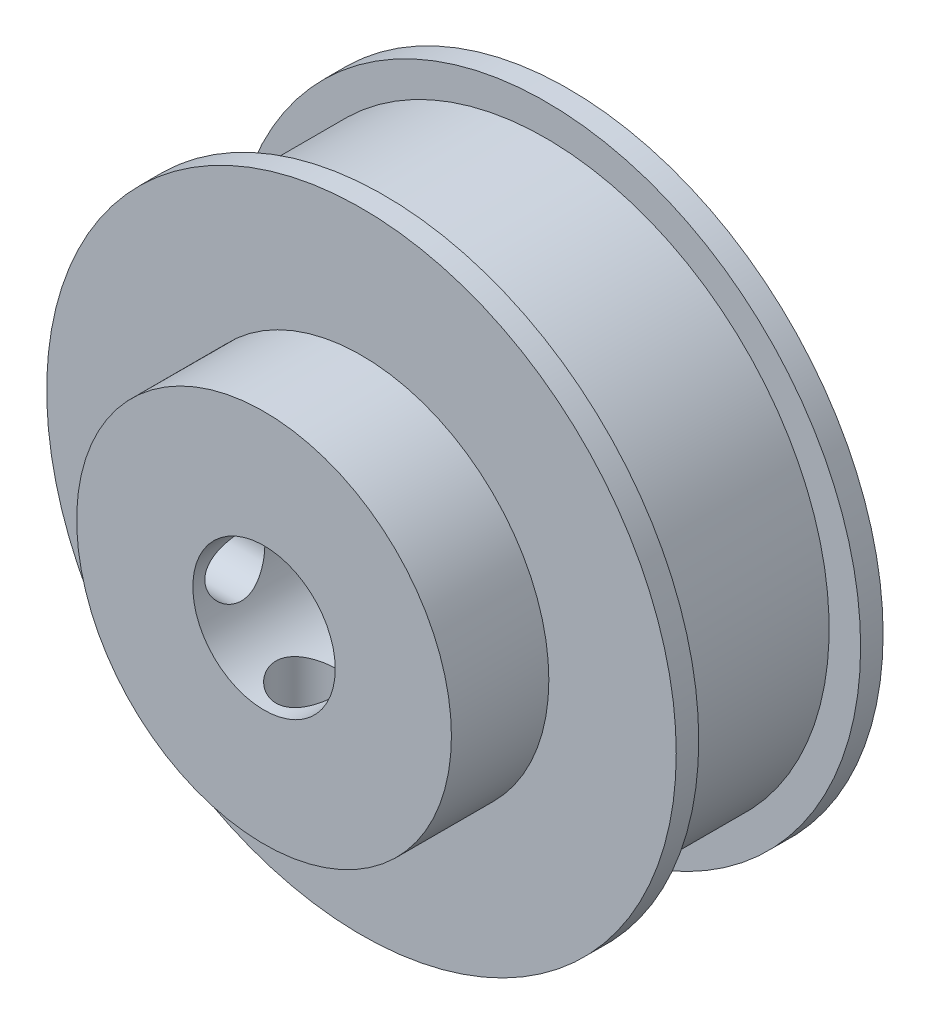
from build123d import *

# Parameters (mm, degrees)
CROQUIS1_R              = 21
SALIENTE_EXTRUIR1_DEPTH = 1.5
CROQUIS2_R              = 18.9
SALIENTE_EXTRUIR2_DEPTH = 10.8
CROQUIS3_R              = 21
SALIENTE_EXTRUIR3_DEPTH = 1.5
CROQUIS8_R              = 12.5
SALIENTE_EXTRUIR5_DEPTH = 6.5
CROQUIS6_R              = 2
CORTAR_EXTRUIR3_DEPTH   = 36.973462441
CROQUIS5_R              = 2
CORTAR_EXTRUIR2_DEPTH   = 36.973462498
CROQUIS4_R              = 4.75
CORTAR_EXTRUIR1_DEPTH   = 36.973462441


with BuildPart() as part:
    # Croquis1 → Saliente-Extruir1 (new body)
    with BuildSketch(Plane.XY):
        Circle(CROQUIS1_R)
    extrude(amount=SALIENTE_EXTRUIR1_DEPTH)

    # Croquis2 → Saliente-Extruir2 (add)
    with BuildSketch(Plane.XY.offset(1.5)):
        with Locations(Location((0, 0, 0), (0, 0, 180))):
            Circle(CROQUIS2_R)
    extrude(amount=SALIENTE_EXTRUIR2_DEPTH)

    # Croquis3 → Saliente-Extruir3 (add)
    with BuildSketch(Plane.XY.offset(12.3)):
        Circle(CROQUIS3_R)
    extrude(amount=SALIENTE_EXTRUIR3_DEPTH)

    # Croquis8 → Saliente-Extruir5 (add)
    with BuildSketch(Plane.XY.offset(13.8)):
        with Locations(Location((0, 0, 0), (0, 0, 180))):
            Circle(CROQUIS8_R)
    extrude(amount=SALIENTE_EXTRUIR5_DEPTH)

    # Croquis6 → Cortar-Extruir3 (cut, through all)
    with BuildSketch(Plane(origin=(0, 0, 0), x_dir=(1, 0, 0), z_dir=(0, 1, 0))):
        with Locations(Location((0, -17.5, 0), (0, 0, 270))):
            Circle(CROQUIS6_R)
    extrude(amount=-CORTAR_EXTRUIR3_DEPTH, mode=Mode.SUBTRACT)

    # Croquis5 → Cortar-Extruir2 (cut, through all)
    with BuildSketch(Plane(origin=(0, 0, 0), x_dir=(0, 0, -1), z_dir=(1, 0, 0))):
        with Locations(Location((-17.5, 0, 0), (0, 0, 180))):
            Circle(CROQUIS5_R)
    extrude(amount=-CORTAR_EXTRUIR2_DEPTH, mode=Mode.SUBTRACT)

    # Croquis4 → Cortar-Extruir1 (cut, through all)
    with BuildSketch(Plane.XY.offset(20.3)):
        Circle(CROQUIS4_R)
    extrude(amount=-CORTAR_EXTRUIR1_DEPTH, mode=Mode.SUBTRACT)


solid = part.part
